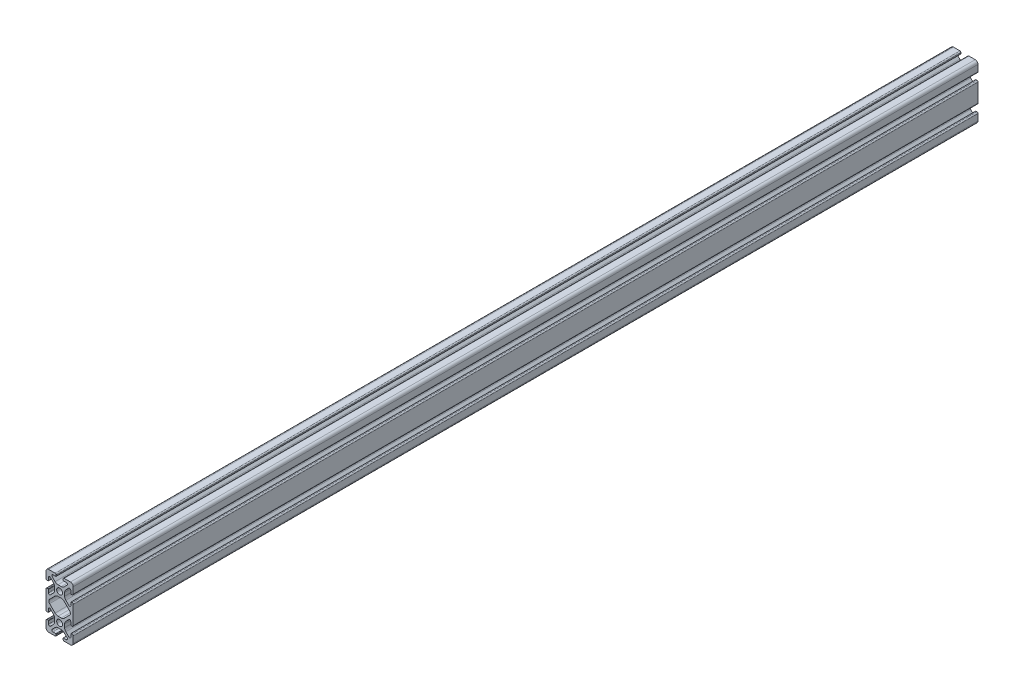
from build123d import *

# Parameters (mm, degrees)
SKETCH3_R           = 2.15
BOSS_EXTRUDE1_DEPTH = 304.8
CIRPATTERN1_COUNT   = 2
BOSS_EXTRUDE2_START = 27.5
SKETCH4_R           = 2.15
BOSS_EXTRUDE2_DEPTH = 27.5


with BuildPart() as part:
    # Sketch3 → Boss-Extrude1 (new, symmetric)
    with BuildSketch(Plane.XY):
        with BuildLine():
            Line((-8.5, 7.5), (-9.2, 7.5))
            ThreePointArc((-9.2, 7.5), (-9.765685425, 7.265685425), (-10, 6.7))
            Line((-10, 6.7), (-10, 0))
            Line((-10, 0), (-7.916458339, 0))
            ThreePointArc((-7.916458339, 0), (-7.764217404, 0.765366865), (-7.330671901, 1.414213562))
            Line((-7.330671901, 1.414213562), (-3.32356512, 5.421320344))
            ThreePointArc((-3.32356512, 5.421320344), (-2.350295073, 6.071638598), (-1.202244776, 6.3))
            Line((-1.202244776, 6.3), (1.202244776, 6.3))
            ThreePointArc((1.202244776, 6.3), (2.350295073, 6.071638598), (3.32356512, 5.421320344))
            Line((3.32356512, 5.421320344), (7.330671901, 1.414213562))
            ThreePointArc((7.330671901, 1.414213562), (7.764217404, 0.765366865), (7.916458339, 0))
            Line((7.916458339, 0), (10, 0))
            Line((10, 0), (10, 6.7))
            ThreePointArc((10, 6.7), (9.765685425, 7.265685425), (9.2, 7.5))
            Line((9.2, 7.5), (8.5, 7.5))
            ThreePointArc((8.5, 7.5), (8.287867966, 7.412132034), (8.2, 7.2))
            Line((8.2, 7.2), (8.2, 5.094911614))
            ThreePointArc((8.2, 5.094911614), (7.678422063, 4.314315067), (6.757645654, 4.497468882))
            Line((6.757645654, 4.497468882), (4.578679656, 6.67643488))
            ThreePointArc((4.578679656, 6.67643488), (3.928361402, 7.649704927), (3.7, 8.797755224))
            Line((3.7, 8.797755224), (3.7, 11.202244776))
            ThreePointArc((3.7, 11.202244776), (3.928361402, 12.350295073), (4.578679656, 13.32356512))
            Line((4.578679656, 13.32356512), (6.757645654, 15.502531118))
            ThreePointArc((6.757645654, 15.502531118), (7.678422063, 15.685684933), (8.2, 14.905088386))
            Line((8.2, 14.905088386), (8.2, 12.8))
            ThreePointArc((8.2, 12.8), (8.287867966, 12.587867966), (8.5, 12.5))
            Line((8.5, 12.5), (9.2, 12.5))
            ThreePointArc((9.2, 12.5), (9.765685425, 12.734314575), (10, 13.3))
            Line((10, 13.3), (10, 18))
            ThreePointArc((10, 18), (9.414213562, 19.414213562), (8, 20))
            Line((8, 20), (3.3, 20))
            ThreePointArc((3.3, 20), (2.734314575, 19.765685425), (2.5, 19.2))
            Line((2.5, 19.2), (2.5, 18.5))
            ThreePointArc((2.5, 18.5), (2.587867966, 18.287867966), (2.8, 18.2))
            Line((2.8, 18.2), (4.905088386, 18.2))
            ThreePointArc((4.905088386, 18.2), (5.685684933, 17.678422063), (5.502531118, 16.757645654))
            Line((5.502531118, 16.757645654), (3.32356512, 14.578679656))
            ThreePointArc((3.32356512, 14.578679656), (2.350295073, 13.928361402), (1.202244776, 13.7))
            Line((1.202244776, 13.7), (-1.202244776, 13.7))
            ThreePointArc((-1.202244776, 13.7), (-2.350295073, 13.928361402), (-3.32356512, 14.578679656))
            Line((-3.32356512, 14.578679656), (-5.502531118, 16.757645654))
            ThreePointArc((-5.502531118, 16.757645654), (-5.685684933, 17.678422063), (-4.905088386, 18.2))
            Line((-4.905088386, 18.2), (-2.8, 18.2))
            ThreePointArc((-2.8, 18.2), (-2.587867966, 18.287867966), (-2.5, 18.5))
            Line((-2.5, 18.5), (-2.5, 19.2))
            ThreePointArc((-2.5, 19.2), (-2.734314575, 19.765685425), (-3.3, 20))
            Line((-3.3, 20), (-8, 20))
            ThreePointArc((-8, 20), (-9.414213562, 19.414213562), (-10, 18))
            Line((-10, 18), (-10, 13.3))
            ThreePointArc((-10, 13.3), (-9.765685425, 12.734314575), (-9.2, 12.5))
            Line((-9.2, 12.5), (-8.5, 12.5))
            ThreePointArc((-8.5, 12.5), (-8.287867966, 12.587867966), (-8.2, 12.8))
            Line((-8.2, 12.8), (-8.2, 14.905088386))
            ThreePointArc((-8.2, 14.905088386), (-7.678422063, 15.685684933), (-6.757645654, 15.502531118))
            Line((-6.757645654, 15.502531118), (-4.578679656, 13.32356512))
            ThreePointArc((-4.578679656, 13.32356512), (-3.928361402, 12.350295073), (-3.7, 11.202244776))
            Line((-3.7, 11.202244776), (-3.7, 8.797755224))
            ThreePointArc((-3.7, 8.797755224), (-3.928361402, 7.649704927), (-4.578679656, 6.67643488))
            Line((-4.578679656, 6.67643488), (-6.757645654, 4.497468882))
            ThreePointArc((-6.757645654, 4.497468882), (-7.678422063, 4.314315067), (-8.2, 5.094911614))
            Line((-8.2, 5.094911614), (-8.2, 7.2))
            ThreePointArc((-8.2, 7.2), (-8.287867966, 7.412132034), (-8.5, 7.5))
        make_face()
        with Locations(Location((0, 10, 0), (0, 0, 180))):
            Circle(SKETCH3_R, mode=Mode.SUBTRACT)
    boss_extrude1 = extrude(amount=BOSS_EXTRUDE1_DEPTH, both=True)

    # CirPattern1: Boss-Extrude1 ×2 about axis
    cirpattern1_axis = Axis((0, 0, 0), (0, 0, 1))
    for i in range(1, CIRPATTERN1_COUNT):
        add(boss_extrude1.rotate(cirpattern1_axis, i * 360 / CIRPATTERN1_COUNT))

    # Sketch4 → Boss-Extrude2 (add)
    with BuildSketch(Plane.XY.offset(304.8).offset(BOSS_EXTRUDE2_START)):
        with BuildLine():
            Line((-2.5, 18.5), (-2.5, 19.2))
            ThreePointArc((-2.5, 19.2), (-2.734314575, 19.765685425), (-3.3, 20))
            Line((-3.3, 20), (-8, 20))
            ThreePointArc((-8, 20), (-9.414213562, 19.414213562), (-10, 18))
            Line((-10, 18), (-10, 13.3))
            ThreePointArc((-10, 13.3), (-9.765685425, 12.734314575), (-9.2, 12.5))
            Line((-9.2, 12.5), (-8.5, 12.5))
            ThreePointArc((-8.5, 12.5), (-8.287867966, 12.587867966), (-8.2, 12.8))
            Line((-8.2, 12.8), (-8.2, 14.905088386))
            ThreePointArc((-8.2, 14.905088386), (-7.678422063, 15.685684933), (-6.757645654, 15.502531118))
            Line((-6.757645654, 15.502531118), (-4.578679656, 13.32356512))
            ThreePointArc((-4.578679656, 13.32356512), (-3.928361402, 12.350295073), (-3.7, 11.202244776))
            Line((-3.7, 11.202244776), (-3.7, 8.797755224))
            ThreePointArc((-3.7, 8.797755224), (-3.928361402, 7.649704927), (-4.578679656, 6.67643488))
            Line((-4.578679656, 6.67643488), (-6.757645654, 4.497468882))
            ThreePointArc((-6.757645654, 4.497468882), (-7.678422063, 4.314315067), (-8.2, 5.094911614))
            Line((-8.2, 5.094911614), (-8.2, 7.2))
            ThreePointArc((-8.2, 7.2), (-8.287867966, 7.412132034), (-8.5, 7.5))
            Line((-8.5, 7.5), (-9.2, 7.5))
            ThreePointArc((-9.2, 7.5), (-9.765685425, 7.265685425), (-10, 6.7))
            Line((-10, 6.7), (-10, -6.7))
            ThreePointArc((-10, -6.7), (-9.765685425, -7.265685425), (-9.2, -7.5))
            Line((-9.2, -7.5), (-8.5, -7.5))
            ThreePointArc((-8.5, -7.5), (-8.287867966, -7.412132034), (-8.2, -7.2))
            Line((-8.2, -7.2), (-8.2, -5.094911614))
            ThreePointArc((-8.2, -5.094911614), (-7.678422063, -4.314315067), (-6.757645654, -4.497468882))
            Line((-6.757645654, -4.497468882), (-4.578679656, -6.67643488))
            ThreePointArc((-4.578679656, -6.67643488), (-3.928361402, -7.649704927), (-3.7, -8.797755224))
            Line((-3.7, -8.797755224), (-3.7, -11.202244776))
            ThreePointArc((-3.7, -11.202244776), (-3.928361402, -12.350295073), (-4.578679656, -13.32356512))
            Line((-4.578679656, -13.32356512), (-6.757645654, -15.502531118))
            ThreePointArc((-6.757645654, -15.502531118), (-7.678422063, -15.685684933), (-8.2, -14.905088386))
            Line((-8.2, -14.905088386), (-8.2, -12.8))
            ThreePointArc((-8.2, -12.8), (-8.287867966, -12.587867966), (-8.5, -12.5))
            Line((-8.5, -12.5), (-9.2, -12.5))
            ThreePointArc((-9.2, -12.5), (-9.765685425, -12.734314575), (-10, -13.3))
            Line((-10, -13.3), (-10, -18))
            ThreePointArc((-10, -18), (-9.414213562, -19.414213562), (-8, -20))
            Line((-8, -20), (-3.3, -20))
            ThreePointArc((-3.3, -20), (-2.734314575, -19.765685425), (-2.5, -19.2))
            Line((-2.5, -19.2), (-2.5, -18.5))
            ThreePointArc((-2.5, -18.5), (-2.587867966, -18.287867966), (-2.8, -18.2))
            Line((-2.8, -18.2), (-4.905088386, -18.2))
            ThreePointArc((-4.905088386, -18.2), (-5.685684933, -17.678422063), (-5.502531118, -16.757645654))
            Line((-5.502531118, -16.757645654), (-3.32356512, -14.578679656))
            ThreePointArc((-3.32356512, -14.578679656), (-2.350295073, -13.928361402), (-1.202244776, -13.7))
            Line((-1.202244776, -13.7), (1.202244776, -13.7))
            ThreePointArc((1.202244776, -13.7), (2.350295073, -13.928361402), (3.32356512, -14.578679656))
            Line((3.32356512, -14.578679656), (5.502531118, -16.757645654))
            ThreePointArc((5.502531118, -16.757645654), (5.685684933, -17.678422063), (4.905088386, -18.2))
            Line((4.905088386, -18.2), (2.8, -18.2))
            ThreePointArc((2.8, -18.2), (2.587867966, -18.287867966), (2.5, -18.5))
            Line((2.5, -18.5), (2.5, -19.2))
            ThreePointArc((2.5, -19.2), (2.734314575, -19.765685425), (3.3, -20))
            Line((3.3, -20), (8, -20))
            ThreePointArc((8, -20), (9.414213562, -19.414213562), (10, -18))
            Line((10, -18), (10, -13.3))
            ThreePointArc((10, -13.3), (9.765685425, -12.734314575), (9.2, -12.5))
            Line((9.2, -12.5), (8.5, -12.5))
            ThreePointArc((8.5, -12.5), (8.287867966, -12.587867966), (8.2, -12.8))
            Line((8.2, -12.8), (8.2, -14.905088386))
            ThreePointArc((8.2, -14.905088386), (7.678422063, -15.685684933), (6.757645654, -15.502531118))
            Line((6.757645654, -15.502531118), (4.578679656, -13.32356512))
            ThreePointArc((4.578679656, -13.32356512), (3.928361402, -12.350295073), (3.7, -11.202244776))
            Line((3.7, -11.202244776), (3.7, -8.797755224))
            ThreePointArc((3.7, -8.797755224), (3.928361402, -7.649704927), (4.578679656, -6.67643488))
            Line((4.578679656, -6.67643488), (6.757645654, -4.497468882))
            ThreePointArc((6.757645654, -4.497468882), (7.678422063, -4.314315067), (8.2, -5.094911614))
            Line((8.2, -5.094911614), (8.2, -7.2))
            ThreePointArc((8.2, -7.2), (8.287867966, -7.412132034), (8.5, -7.5))
            Line((8.5, -7.5), (9.2, -7.5))
            ThreePointArc((9.2, -7.5), (9.765685425, -7.265685425), (10, -6.7))
            Line((10, -6.7), (10, 6.7))
            ThreePointArc((10, 6.7), (9.765685425, 7.265685425), (9.2, 7.5))
            Line((9.2, 7.5), (8.5, 7.5))
            ThreePointArc((8.5, 7.5), (8.287867966, 7.412132034), (8.2, 7.2))
            Line((8.2, 7.2), (8.2, 5.094911614))
            ThreePointArc((8.2, 5.094911614), (7.678422063, 4.314315067), (6.757645654, 4.497468882))
            Line((6.757645654, 4.497468882), (4.578679656, 6.67643488))
            ThreePointArc((4.578679656, 6.67643488), (3.928361402, 7.649704927), (3.7, 8.797755224))
            Line((3.7, 8.797755224), (3.7, 11.202244776))
            ThreePointArc((3.7, 11.202244776), (3.928361402, 12.350295073), (4.578679656, 13.32356512))
            Line((4.578679656, 13.32356512), (6.757645654, 15.502531118))
            ThreePointArc((6.757645654, 15.502531118), (7.678422063, 15.685684933), (8.2, 14.905088386))
            Line((8.2, 14.905088386), (8.2, 12.8))
            ThreePointArc((8.2, 12.8), (8.287867966, 12.587867966), (8.5, 12.5))
            Line((8.5, 12.5), (9.2, 12.5))
            ThreePointArc((9.2, 12.5), (9.765685425, 12.734314575), (10, 13.3))
            Line((10, 13.3), (10, 18))
            ThreePointArc((10, 18), (9.414213562, 19.414213562), (8, 20))
            Line((8, 20), (3.3, 20))
            ThreePointArc((3.3, 20), (2.734314575, 19.765685425), (2.5, 19.2))
            Line((2.5, 19.2), (2.5, 18.5))
            ThreePointArc((2.5, 18.5), (2.587867966, 18.287867966), (2.8, 18.2))
            Line((2.8, 18.2), (4.905088386, 18.2))
            ThreePointArc((4.905088386, 18.2), (5.685684933, 17.678422063), (5.502531118, 16.757645654))
            Line((5.502531118, 16.757645654), (3.32356512, 14.578679656))
            ThreePointArc((3.32356512, 14.578679656), (2.350295073, 13.928361402), (1.202244776, 13.7))
            Line((1.202244776, 13.7), (-1.202244776, 13.7))
            ThreePointArc((-1.202244776, 13.7), (-2.350295073, 13.928361402), (-3.32356512, 14.578679656))
            Line((-3.32356512, 14.578679656), (-5.502531118, 16.757645654))
            ThreePointArc((-5.502531118, 16.757645654), (-5.685684933, 17.678422063), (-4.905088386, 18.2))
            Line((-4.905088386, 18.2), (-2.8, 18.2))
            ThreePointArc((-2.8, 18.2), (-2.587867966, 18.287867966), (-2.5, 18.5))
        make_face()
        with Locations(Location((0, 10, 0), (0, 0, 180))):
            Circle(SKETCH4_R, mode=Mode.SUBTRACT)
        with Locations(Location((0, -10, 0), (0, 0, 90))):
            Circle(SKETCH4_R, mode=Mode.SUBTRACT)
        with BuildLine():
            Line((7.330671901, -1.414213562), (3.32356512, -5.421320344))
            ThreePointArc((3.32356512, -5.421320344), (2.350295073, -6.071638598), (1.202244776, -6.3))
            Line((1.202244776, -6.3), (-1.202244776, -6.3))
            ThreePointArc((-1.202244776, -6.3), (-2.350295073, -6.071638598), (-3.32356512, -5.421320344))
            Line((-3.32356512, -5.421320344), (-7.330671901, -1.414213562))
            ThreePointArc((-7.330671901, -1.414213562), (-7.916458339, 0), (-7.330671901, 1.414213562))
            Line((-7.330671901, 1.414213562), (-3.32356512, 5.421320344))
            ThreePointArc((-3.32356512, 5.421320344), (-2.350295073, 6.071638598), (-1.202244776, 6.3))
            Line((-1.202244776, 6.3), (1.202244776, 6.3))
            ThreePointArc((1.202244776, 6.3), (2.350295073, 6.071638598), (3.32356512, 5.421320344))
            Line((3.32356512, 5.421320344), (7.330671901, 1.414213562))
            ThreePointArc((7.330671901, 1.414213562), (7.916458339, 0), (7.330671901, -1.414213562))
        make_face(mode=Mode.SUBTRACT)
    boss_extrude2 = extrude(amount=-BOSS_EXTRUDE2_DEPTH)

    # Mirror1: Boss-Extrude2 across plane
    add(boss_extrude2.mirror(Plane.XY))


solid = part.part
